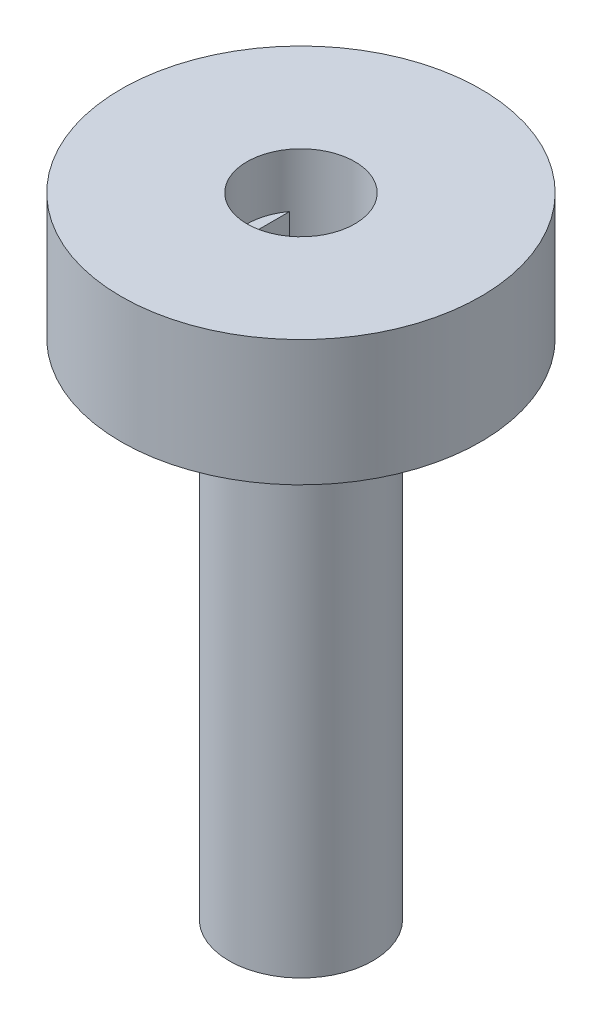
from build123d import *

# Parameters (mm, degrees)
ESQUISSE1_R             = 4
BOSS_EXTRU_1_DEPTH      = 35
ESQUISSE2_R             = 3
ENL_V_MAT_EXTRU_1_DEPTH = 13
BOSS_EXTRU_2_START      = 10
BOSS_EXTRU_2_DEPTH      = 10
ESQUISSE5_R             = 10
ESQUISSE5_R_2           = 4
BOSS_EXTRU_3_DEPTH      = 7


with BuildPart() as part:
    # Esquisse1 → Boss.-Extru.1 (new body)
    with BuildSketch(Plane(origin=(0, 0, 0), x_dir=(1, 0, 0), z_dir=(0, 1, 0))):
        with Locations(Location((0, 0, 0), (0, 0, 270))):
            Circle(ESQUISSE1_R)
    extrude(amount=-BOSS_EXTRU_1_DEPTH)

    # Esquisse2 → Enlèv. mat.-Extru.1 (cut)
    with BuildSketch(Plane(origin=(0, 0, 0), x_dir=(1, 0, 0), z_dir=(0, 1, 0))):
        with Locations(Location((0, 0, 0), (0, 0, 270))):
            Circle(ESQUISSE2_R)
    extrude(amount=-ENL_V_MAT_EXTRU_1_DEPTH, mode=Mode.SUBTRACT)

    # Esquisse4 → Boss.-Extru.2 (add)
    with BuildSketch(Plane(origin=(0, -13, 0), x_dir=(1, 0, 0), z_dir=(0, 1, 0)).offset(BOSS_EXTRU_2_START)):
        with BuildLine():
            Line((-2.41, -1.786588929), (-2.41, 0))
            Line((-2.41, 0), (-2.41, 1.786588929))
            ThreePointArc((-2.41, 1.786588929), (-3, 0), (-2.41, -1.786588929))
        make_face()
    extrude(amount=-BOSS_EXTRU_2_DEPTH)

    # Esquisse5 → Boss.-Extru.3 (add)
    with BuildSketch(Plane(origin=(0, 0, 0), x_dir=(1, 0, 0), z_dir=(0, 1, 0))):
        with Locations(Location((0, 0, 0), (0, 0, 270))):
            Circle(ESQUISSE5_R)
        with Locations(Location((0, 0, 0), (0, 0, 270))):
            Circle(ESQUISSE5_R_2, mode=Mode.SUBTRACT)
    extrude(amount=-BOSS_EXTRU_3_DEPTH)


solid = part.part
